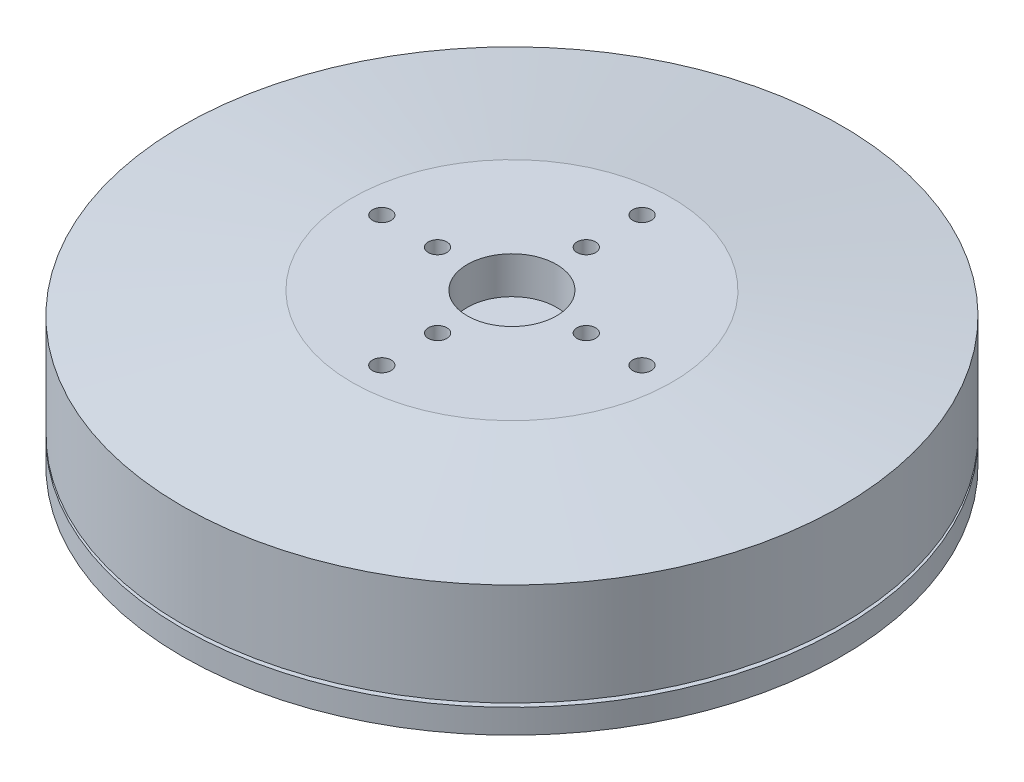
from build123d import *

# Parameters (mm, degrees)
M3X0_5_TAPPED_HOLE1_D     = 2.5
M3X0_5_TAPPED_HOLE1_DEPTH = 6.5
M3X0_5_TAPPED_HOLE1_TIP   = 0.751075774
SKETCH4_R                 = 6
CUT_EXTRUDE1_DEPTH        = 5
M3X0_5_TAPPED_HOLE2_D     = 2.5
M3X0_5_TAPPED_HOLE2_DEPTH = 6.5
M3X0_5_TAPPED_HOLE2_TIP   = 0.751075774


with BuildPart() as part:
    # Sketch1 → Revolve1 (revolve)
    with BuildSketch(Plane.XY):
        Polygon((0, -10.75), (0, 10.75), (-21.5, 10.75), (-44.325, 7.75), (-44.325, -6), (-40.7625, -6), (-40.7625, -6.5), (-44.325, -6.5), (-44.325, -9.75), (-35, -10.75), align=None)
    revolve(axis=Axis((0, 0, 0), (0, -1, 0)))

    # M3x0.5 Tapped Hole1
    with Locations(Plane(origin=(0, 10.75, 0), x_dir=(1, 0, 0), z_dir=(0, 1, 0))):
        with Locations((0, 17.5), (0, 10), (17.5, 0), (10, 0), (0, -17.5), (0, -10), (-17.5, 0), (-10, 0)):
            Hole(M3X0_5_TAPPED_HOLE1_D / 2, depth=M3X0_5_TAPPED_HOLE1_DEPTH)
            with Locations((0, 0, -(M3X0_5_TAPPED_HOLE1_DEPTH + M3X0_5_TAPPED_HOLE1_TIP / 2))):  # 118° drill point
                Cone(0, M3X0_5_TAPPED_HOLE1_D / 2, M3X0_5_TAPPED_HOLE1_TIP, mode=Mode.SUBTRACT)

    # Sketch4 → Cut-Extrude1 (cut)
    with BuildSketch(Plane(origin=(0, 10.75, 0), x_dir=(1, 0, 0), z_dir=(0, 1, 0))):
        Circle(SKETCH4_R)
    extrude(amount=-CUT_EXTRUDE1_DEPTH, mode=Mode.SUBTRACT)

    # M3x0.5 Tapped Hole2
    with Locations(Plane(origin=(0, -10.75, 0), x_dir=(-1, 0, 0), z_dir=(0, -1, 0))):
        with Locations((0, 15), (15, 0), (0, -15), (-15, 0)):
            Hole(M3X0_5_TAPPED_HOLE2_D / 2, depth=M3X0_5_TAPPED_HOLE2_DEPTH)
            with Locations((0, 0, -(M3X0_5_TAPPED_HOLE2_DEPTH + M3X0_5_TAPPED_HOLE2_TIP / 2))):  # 118° drill point
                Cone(0, M3X0_5_TAPPED_HOLE2_D / 2, M3X0_5_TAPPED_HOLE2_TIP, mode=Mode.SUBTRACT)


solid = part.part
